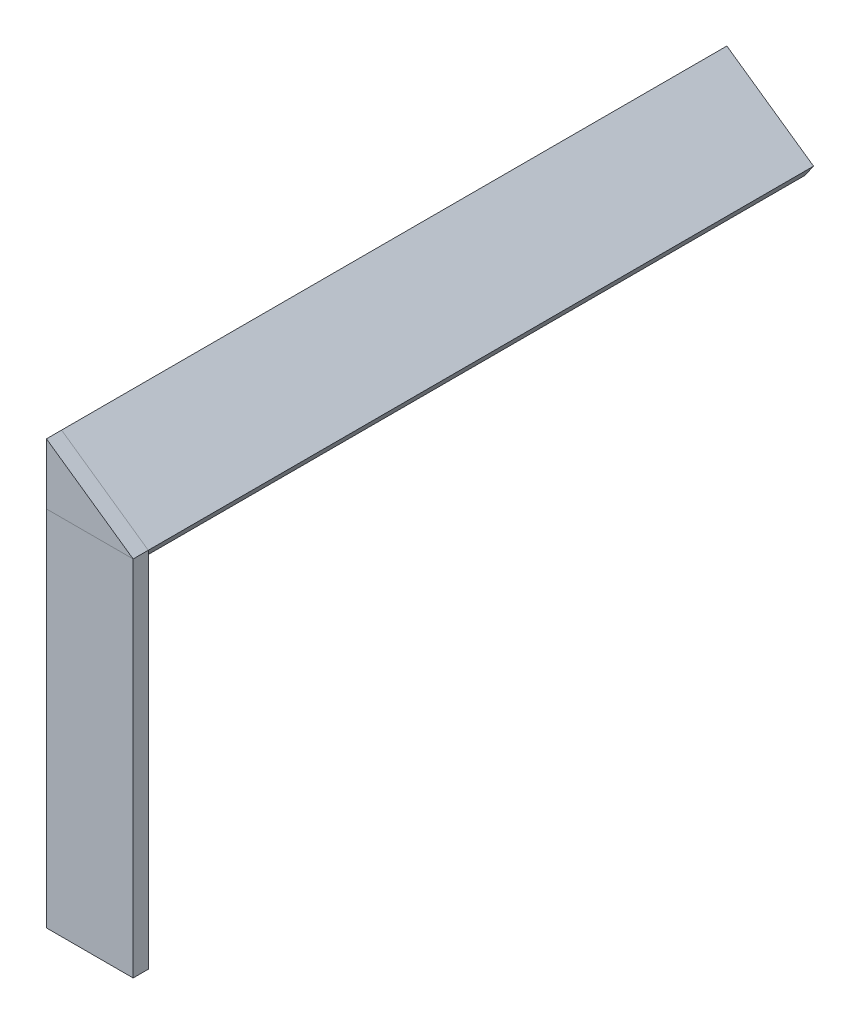
from build123d import *

# Parameters (mm, degrees)
BOSS_EXTRUDE1_DEPTH = 6.35
SKETCH2_W           = 36.411308368
SKETCH2_H           = 152.4
BOSS_EXTRUDE2_DEPTH = 6.35
BOSS_EXTRUDE3_DEPTH = 279.4


with BuildPart() as part:
    # Sketch1 → Boss-Extrude1 (new body)
    with BuildSketch(Plane.XY):
        Polygon((-18.205654184, 25.495472596), (18.205654184, 0), (-18.205654184, 0), align=None)
    extrude(amount=BOSS_EXTRUDE1_DEPTH)


with BuildPart() as body_2:
    # Sketch2 → Boss-Extrude2 (new body)
    with BuildSketch(Plane.XY):
        with Locations((0, -76.2)):
            Rectangle(SKETCH2_W, SKETCH2_H)
    extrude(amount=BOSS_EXTRUDE2_DEPTH)


with BuildPart() as body_3:
    # Sketch3 → Boss-Extrude3 (new body)
    with BuildSketch(Plane.XY):
        Polygon((-18.205654184, 25.495472596), (18.205654184, 0), (14.563443813, -5.201615481), (-21.847864555, 20.293857115), align=None)
    extrude(amount=-BOSS_EXTRUDE3_DEPTH)


solid = Compound([part.part, body_2.part, body_3.part])
